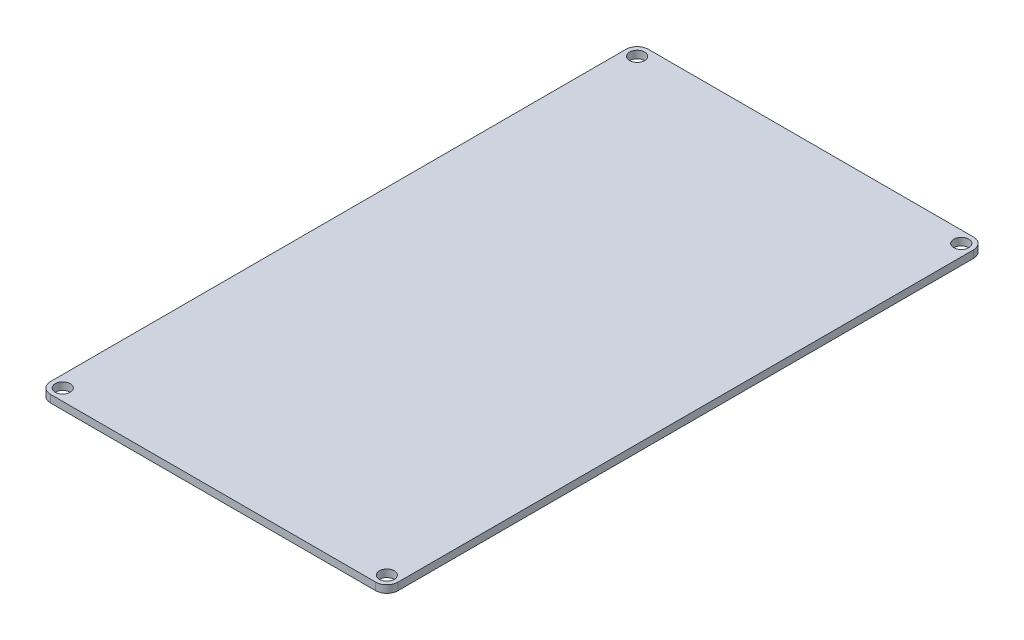
from build123d import *

# Parameters (mm, degrees)
SKETCH2_R           = 2
BOSS_EXTRUDE1_DEPTH = 2
FILLET13_R          = 3


with BuildPart() as part:
    # Sketch2 → Boss-Extrude1 (new body)
    with BuildSketch(Plane(origin=(0, 0, 0), x_dir=(1, 0, 0), z_dir=(0, 1, 0))):
        Polygon((0, 37.5), (0, 0), (59, 0), (93, 0), (93, 160), (0, 160), (0, 137.5), align=None)
        with Locations(Location((3.12102555, 3.12102555, 0), (0, 0, 270))):
            Circle(SKETCH2_R, mode=Mode.SUBTRACT)
        with Locations(Location((89.87897445, 3.12102555, 0), (0, 0, 270))):
            Circle(SKETCH2_R, mode=Mode.SUBTRACT)
        with Locations(Location((3.12102555, 156.87897445, 0), (0, 0, 270))):
            Circle(SKETCH2_R, mode=Mode.SUBTRACT)
        with Locations(Location((89.87897445, 156.87897445, 0), (0, 0, 270))):
            Circle(SKETCH2_R, mode=Mode.SUBTRACT)
    extrude(amount=BOSS_EXTRUDE1_DEPTH)

    # Fillet13
    fillet13_edges = [part.edges().sort_by_distance(p)[0] for p in [
        (93, 1, -160),
        (93, 1, 0),
        (0, 1, 0),
        (0, 1, -160),
    ]]
    fillet(fillet13_edges, radius=FILLET13_R)


solid = part.part
